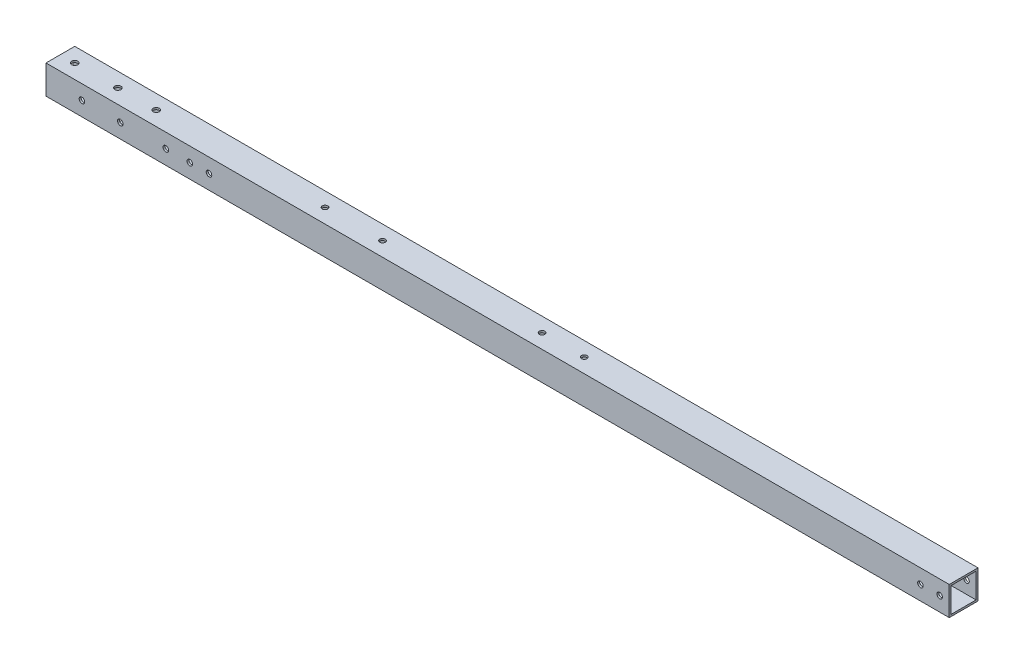
from build123d import *

# Parameters (mm, degrees)
SKETCH_11_W         = 15
SKETCH_11_H         = 15
SKETCH_11_W_2       = 13
SKETCH_11_H_2       = 13
F_15X15X1_1_DEPTH   = 471
SKETCH_12_R         = 1.6
CUT_EXTRUDE_1_DEPTH = 237.096378625
SKETCH_13_R         = 1.45
CUT_EXTRUDE_2_DEPTH = 237.096378625
SKETCH_14_R         = 1.45
CUT_EXTRUDE_3_DEPTH = 237.096378625
SKETCH_15_R         = 1.45
CUT_EXTRUDE_4_DEPTH = 237.096378625
SKETCH_16_R         = 1.45
CUT_EXTRUDE_5_DEPTH = 237.096378625
SKETCH_18_R         = 1.45
CUT_EXTRUDE_7_DEPTH = 237.096378625


with BuildPart() as part:
    # 草图11 → 铝管 15X15X1(1) (new body)
    with BuildSketch(Plane(origin=(-235.5, 0, 0), x_dir=(0, 0, -1), z_dir=(1, 0, 0))):
        Rectangle(SKETCH_11_W, SKETCH_11_H)
        Rectangle(SKETCH_11_W_2, SKETCH_11_H_2, mode=Mode.SUBTRACT)
    extrude(amount=F_15X15X1_1_DEPTH)

    # 草图12 → 切除-拉伸1 (cut, through all)
    with BuildSketch(Plane(origin=(0, 7.5, 0), x_dir=(1, 0, 0), z_dir=(0, 1, 0))):
        with Locations(Location((-205.5, 0, 0), (0, 0, 270))):
            Circle(SKETCH_12_R)
        with Locations(Location((-185.5, 0, 0), (0, 0, 270))):
            Circle(SKETCH_12_R)
        with Locations(Location((-228, 0, 0), (0, 0, 270))):
            Circle(SKETCH_12_R)
    extrude(amount=-CUT_EXTRUDE_1_DEPTH, mode=Mode.SUBTRACT)

    # 草图13 → 切除-拉伸2 (cut, through all)
    with BuildSketch(Plane(origin=(0, 7.5, 0), x_dir=(1, 0, 0), z_dir=(0, 1, 0))):
        with Locations(Location((-97.5, 0, 0), (0, 0, 270))):
            Circle(SKETCH_13_R)
        with Locations(Location((-67.5, 0, 0), (0, 0, 270))):
            Circle(SKETCH_13_R)
    extrude(amount=-CUT_EXTRUDE_2_DEPTH, mode=Mode.SUBTRACT)

    # 草图14 → 切除-拉伸3 (cut, through all)
    with BuildSketch(Plane(origin=(0, 0, -7.5), x_dir=(-1, 0, 0), z_dir=(0, 0, -1))):
        with Locations((216.75, 0)):
            Circle(SKETCH_14_R)
        with Locations((196.75, 0)):
            Circle(SKETCH_14_R)
    extrude(amount=-CUT_EXTRUDE_3_DEPTH, mode=Mode.SUBTRACT)

    # 草图15 → 切除-拉伸4 (cut, through all)
    with BuildSketch(Plane(origin=(0, 0, -7.5), x_dir=(-1, 0, 0), z_dir=(0, 0, -1))):
        with Locations((173, 0)):
            Circle(SKETCH_15_R)
        with Locations((160.5, 0)):
            Circle(SKETCH_15_R)
        with Locations((150.5, 0)):
            Circle(SKETCH_15_R)
    extrude(amount=-CUT_EXTRUDE_4_DEPTH, mode=Mode.SUBTRACT)

    # 草图16 → 切除-拉伸5 (cut, through all)
    with BuildSketch(Plane(origin=(0, 0, -7.5), x_dir=(-1, 0, 0), z_dir=(0, 0, -1))):
        with Locations((-230.5, 0)):
            Circle(SKETCH_16_R)
        with Locations((-220.5, 0)):
            Circle(SKETCH_16_R)
    extrude(amount=-CUT_EXTRUDE_5_DEPTH, mode=Mode.SUBTRACT)

    # 草图18 → 切除-拉伸7 (cut, through all)
    with BuildSketch(Plane.XZ.offset(7.5)):
        with Locations(Location((15.7, 0, 0), (0, 0, 270))):
            Circle(SKETCH_18_R)
        with Locations(Location((37.7, 0, 0), (0, 0, 270))):
            Circle(SKETCH_18_R)
    extrude(amount=-CUT_EXTRUDE_7_DEPTH, mode=Mode.SUBTRACT)


solid = part.part
